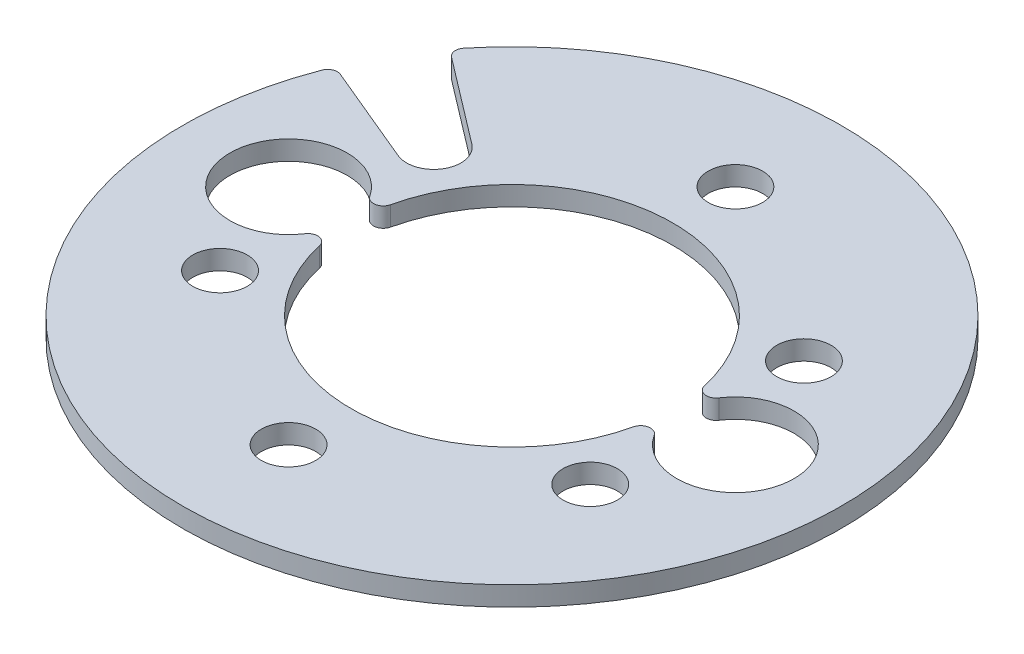
from build123d import *

# Parameters (mm, degrees)
SKETCH1_R           = 4.445
BOSS_EXTRUDE1_DEPTH = 3.175


with BuildPart() as part:
    # Sketch1 → Boss-Extrude1 (new body)
    with BuildSketch(Plane(origin=(0, 0, 0), x_dir=(1, 0, 0), z_dir=(0, 1, 0))):
        with BuildLine():
            Line((-27.551576941, 20.997814364), (-41.546014614, 31.663360114))
            ThreePointArc((-41.546014614, 31.663360114), (-42.160017959, 32.737521423), (-41.816542083, 33.926153808))
            ThreePointArc((-41.816542083, 33.926153808), (46.633735943, -26.924), (-50.289182092, 19.251110838))
            ThreePointArc((-50.289182092, 19.251110838), (-49.431534188, 20.142885865), (-48.194281535, 20.148224024))
            Line((-48.194281535, 20.148224024), (-31.960429133, 13.361458364))
            ThreePointArc((-31.960429133, 13.361458364), (-26.396454307, 15.24), (-27.551576941, 20.997814364))
        make_face()
        with Locations(Location((0, 36.5125, 0), (0, 0, 270))):
            Circle(SKETCH1_R, mode=Mode.SUBTRACT)
        with Locations(Location((0, -36.5125, 0), (0, 0, 270))):
            Circle(SKETCH1_R, mode=Mode.SUBTRACT)
        with Locations(Location((30.245937227, -17.4625, 0), (0, 0, 270))):
            Circle(SKETCH1_R, mode=Mode.SUBTRACT)
        with Locations(Location((30.245937227, 17.4625, 0), (0, 0, 270))):
            Circle(SKETCH1_R, mode=Mode.SUBTRACT)
        with Locations(Location((-30.245937227, -17.4625, 0), (0, 0, 270))):
            Circle(SKETCH1_R, mode=Mode.SUBTRACT)
        with BuildLine():
            ThreePointArc((-25.640504728, -5.80310592), (0, -26.289), (25.640504728, -5.80310592))
            ThreePointArc((25.640504728, -5.80310592), (26.904017035, -4.591795724), (28.513791893, -5.279080705))
            ThreePointArc((28.513791893, -5.279080705), (46.0962375, 0), (28.513791893, 5.279080705))
            ThreePointArc((28.513791893, 5.279080705), (26.904017035, 4.591795724), (25.640504728, 5.80310592))
            ThreePointArc((25.640504728, 5.80310592), (0, 26.289), (-25.640504728, 5.80310592))
            ThreePointArc((-25.640504728, 5.80310592), (-26.904017035, 4.591795724), (-28.513791893, 5.279080705))
            ThreePointArc((-28.513791893, 5.279080705), (-46.0962375, 0), (-28.513791893, -5.279080705))
            ThreePointArc((-28.513791893, -5.279080705), (-26.904017035, -4.591795724), (-25.640504728, -5.80310592))
        make_face(mode=Mode.SUBTRACT)
    extrude(amount=BOSS_EXTRUDE1_DEPTH)


solid = part.part
